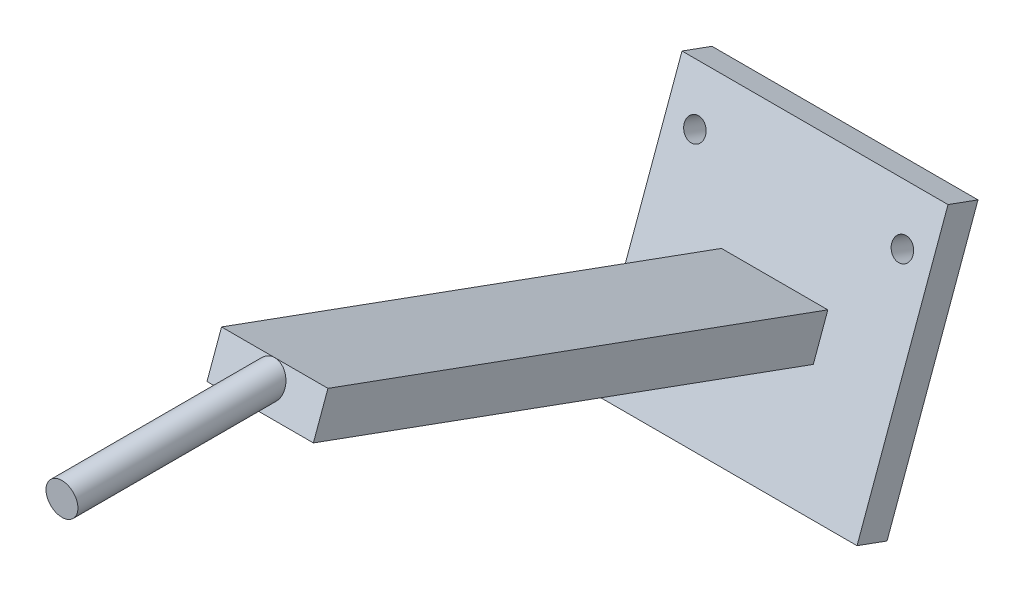
from build123d import *

# Parameters (mm, degrees)
SKETCH_1_R           = 1.5
EXTRUDE_1_DEPTH      = 20
EXTRUDE_2_DEPTH      = 5
EXTRUDE_2_DEPTH_BACK = 5
SKETCH_3_W           = 25
SKETCH_3_H           = 25
EXTRUDE_3_DEPTH      = 3
SKETCH_4_R           = 1
CUT_EXTRUDE_1_DEPTH  = 74.075998302


with BuildPart() as part:
    # 草图1 → 凸台-拉伸1 (new body)
    with BuildSketch(Plane.XY):
        Circle(SKETCH_1_R)
    extrude(amount=EXTRUDE_1_DEPTH)

    # 草图2 → 凸台-拉伸2 (add, two sides: drawn at the far end of the back side and taken through both)
    with BuildSketch(Plane(origin=(0, 0, 0), x_dir=(0, 0, -1), z_dir=(1, 0, 0)).offset(-EXTRUDE_2_DEPTH_BACK)):
        Polygon((0, 1.5), (-1.368080573, -2.258770483), (45.616550466, -19.359777649), (46.984631039, -15.601007166), align=None)
    extrude(amount=EXTRUDE_2_DEPTH + EXTRUDE_2_DEPTH_BACK)

    # 草图3 → 凸台-拉伸3 (add)
    with BuildSketch(Plane(origin=(0, -16.925540499, -46.502540332), x_dir=(-1, 0, 0), z_dir=(0, -0.342020143325663, -0.9396926207859105))):
        Rectangle(SKETCH_3_W, SKETCH_3_H)
    extrude(amount=EXTRUDE_3_DEPTH)

    # 草图4 → 切除-拉伸1 (cut, through all)
    with BuildSketch(Plane(origin=(0, -17.951600929, -49.321618194), x_dir=(-1, 0, 0), z_dir=(0, -0.3420201433256631, -0.9396926207859104))):
        with Locations((-9.75, 8)):
            Circle(SKETCH_4_R)
        with Locations((9.75, 8)):
            Circle(SKETCH_4_R)
    extrude(amount=-CUT_EXTRUDE_1_DEPTH, mode=Mode.SUBTRACT)


solid = part.part
